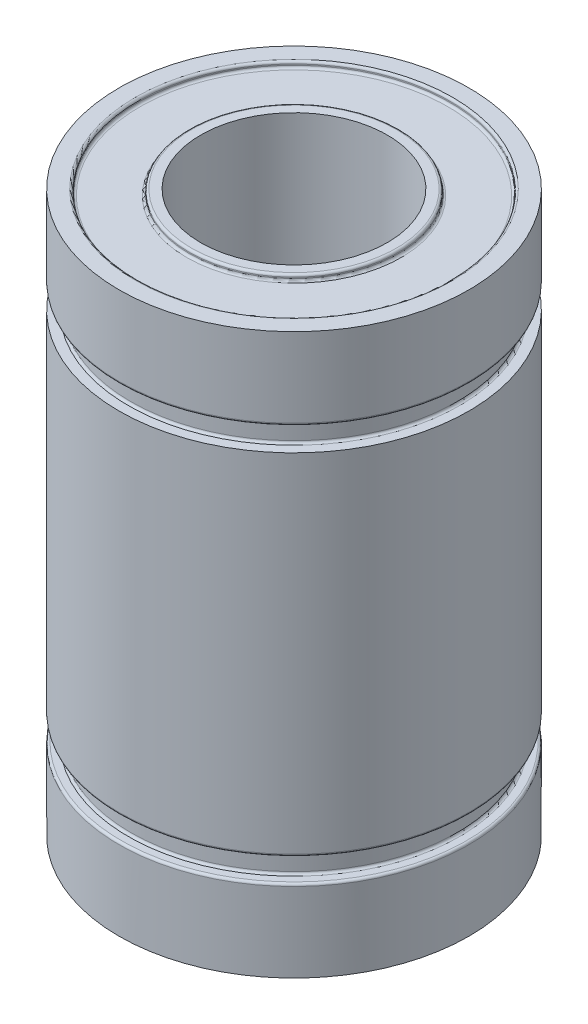
from build123d import *

# Parameters (mm, degrees)
SKETCH1_R           = 7.5
SKETCH1_R_2         = 4
BOSS_EXTRUDE1_DEPTH = 12
SKETCH2_W           = 0.5
SKETCH2_H           = 1
SKETCH3_R           = 6.7
SKETCH3_R_2         = 4.5
CUT_EXTRUDE1_DEPTH  = 0.25
FILLET1_R           = 0.1


with BuildPart() as part:
    # Sketch1 → Boss-Extrude1 (new, symmetric)
    with BuildSketch(Plane(origin=(0, 0, 0), x_dir=(1, 0, 0), z_dir=(0, 1, 0))):
        with Locations(Location((0, 0, 0), (0, 0, 270))):
            Circle(SKETCH1_R)
        with Locations(Location((0, 0, 0), (0, 0, 270))):
            Circle(SKETCH1_R_2, mode=Mode.SUBTRACT)
    extrude(amount=BOSS_EXTRUDE1_DEPTH, both=True)

    # Sketch2 → Cut-Revolve2 (revolve, cut)
    with BuildSketch(Plane.XY, mode=Mode.PRIVATE) as cut_revolve2_sk:
        with Locations((-7.25, 8)):
            Rectangle(SKETCH2_W, SKETCH2_H)
        with Locations((-7.25, -8)):
            Rectangle(SKETCH2_W, SKETCH2_H)
    revolve(cut_revolve2_sk.sketch.rotate(Axis((0, 12, 0), (0, -1, 0)), 270), axis=Axis((0, 12, 0), (0, -1, 0)), mode=Mode.SUBTRACT)

    # Sketch3 → Cut-Extrude1 (cut)
    with BuildSketch(Plane.XZ.offset(12)):
        with Locations(Location((0, 0, 0), (0, 0, 270))):
            Circle(SKETCH3_R)
        with Locations(Location((0, 0, 0), (0, 0, 270))):
            Circle(SKETCH3_R_2, mode=Mode.SUBTRACT)
    cut_extrude1 = extrude(amount=-CUT_EXTRUDE1_DEPTH, mode=Mode.SUBTRACT)

    # Mirror1: Cut-Extrude1 across plane
    add(cut_extrude1.mirror(Plane.ZX), mode=Mode.SUBTRACT)

    # Fillet1
    fillet1_edges = [part.edges().sort_by_distance(p)[0] for p in [
        (0, 7.5, -7),
        (0, 8.5, -7),
        (0, 8.5, -7.5),
        (0, -8.5, -7),
        (0, -7.5, -7),
        (0, -7.5, -7.5),
        (0, -8.5, -7.5),
        (0, -11.75, 6.7),
        (0, -11.75, 4.5),
        (0, -12, 6.7),
        (0, -12, 4.5),
        (0, 11.75, 6.7),
        (0, 12, 4.5),
        (0, 12, 6.7),
        (0, 11.75, 4.5),
    ]]
    fillet(fillet1_edges, radius=FILLET1_R)


solid = part.part
